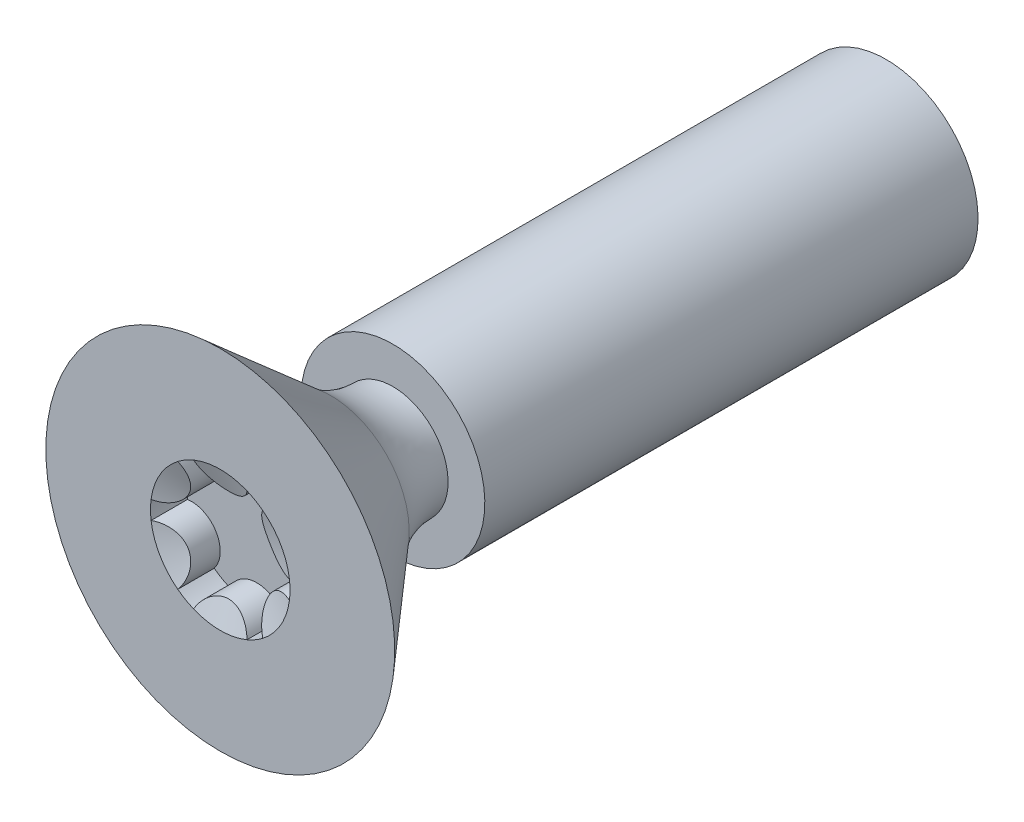
from build123d import *

# Parameters (mm, degrees)
CUT_EXTRUDE14_DEPTH = 0.695706
CIRPATTERN1_COUNT   = 6


with BuildPart() as part:
    # Sketch3 → Revolve1 (revolve)
    with BuildSketch(Plane(origin=(0, 0, 0), x_dir=(0, 0, -1), z_dir=(1, 0, 0)), mode=Mode.PRIVATE) as revolve1_sk:
        with BuildLine():
            Line((-3.056381812, 1.7526), (-3.056381812, 1.05156))
            ThreePointArc((-3.056381812, 1.05156), (-3.689163591, 1.165985586), (-4.2418, 1.494769699))
            Line((-4.2418, 1.494769699), (-6.35, 3.3274))
            Line((-6.35, 3.3274), (-6.35, 0))
            Line((-6.35, 0), (6.35, 0))
            Line((6.35, 0), (6.35, 1.7526))
            Line((6.35, 1.7526), (-3.056381812, 1.7526))
        make_face()
    revolve(revolve1_sk.sketch.rotate(Axis((0, 0, 6.35), (0, 0, -1)), 180), axis=Axis((0, 0, 6.35), (0, 0, -1)))

    # Sketch21 → Cut-Extrude14 (cut)
    with BuildSketch(Plane.XY.offset(6.35)):
        with BuildLine():
            Line((0, 0), (-0.66548, 1.152645171))
            ThreePointArc((-0.66548, 1.152645171), (-0.588668555, 1.193701744), (-0.509336341, 1.229646703))
            ThreePointArc((-0.509336341, 1.229646703), (0, 0.88931904), (0.509336341, 1.229646703))
            ThreePointArc((0.509336341, 1.229646703), (0.588668555, 1.193701744), (0.66548, 1.152645171))
            Line((0.66548, 1.152645171), (0, 0))
        make_face()
    cut_extrude14 = extrude(amount=-CUT_EXTRUDE14_DEPTH, mode=Mode.SUBTRACT)

    # CirPattern1: Cut-Extrude14 ×6 about axis
    cirpattern1_axis = Axis((0, 0, 0), (0, 0, 1))
    for i in range(1, CIRPATTERN1_COUNT):
        add(cut_extrude14.rotate(cirpattern1_axis, i * 360 / CIRPATTERN1_COUNT), mode=Mode.SUBTRACT)

    # Cut-Extrude15 cone 1 section (through the dimple's axis) → Cut-Extrude15 (revolve, cut)
    with BuildSketch(Plane(origin=(0, 0, 6.35), x_dir=(0, -1, 0), z_dir=(1, 0, 0))):
        Polygon((0, 0), (1.33096, 0), (0, 0.484429823), align=None)
    revolve(axis=Axis((0, 0, 6.35), (0, 0, -1)), mode=Mode.SUBTRACT)


solid = part.part
